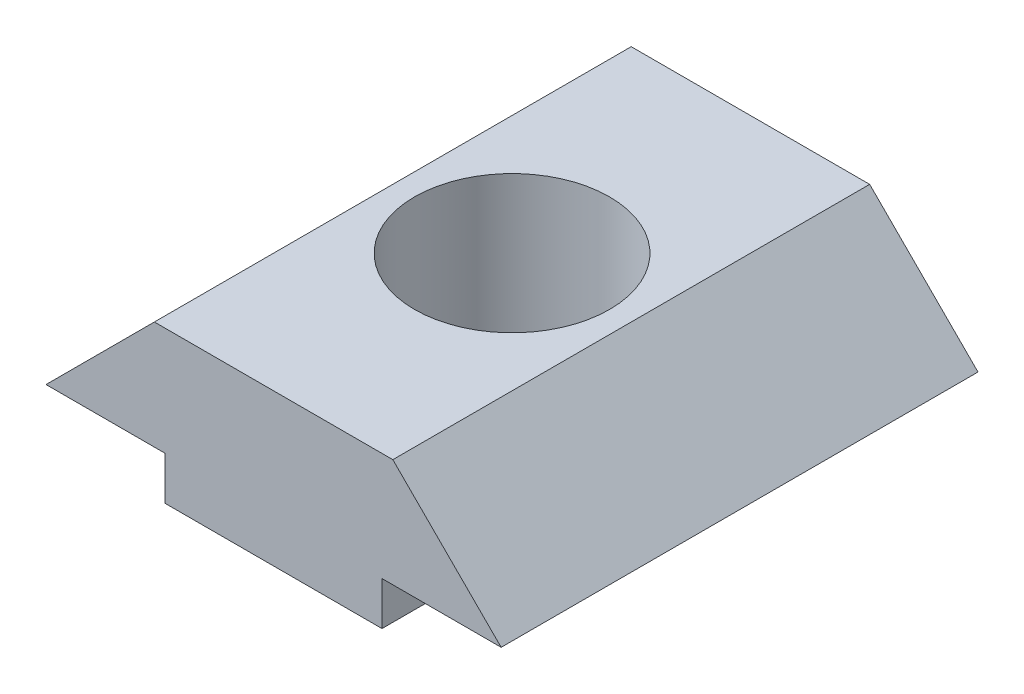
from build123d import *

# Parameters (mm, degrees)
BOSS_EXTRU_1_DEPTH      = 11
ESQUISSE2_R             = 2.25
ENL_V_MAT_EXTRU_1_DEPTH = 13.681186853


with BuildPart() as part:
    # Esquisse1 → Boss.-Extru.1 (new body)
    with BuildSketch(Plane.XY):
        Polygon((2.500951888, 4.75), (-2.5, 4.75), (-2.75, 4.75), (-5.25, 2.25), (-4.5, 2.25), (-2.5, 2.25), (-2.5, 1.25), (2.500951888, 1.25), (2.500951888, 2.25), (4.5, 2.25), (5.25, 2.25), (2.750951888, 4.75), align=None)
    extrude(amount=BOSS_EXTRU_1_DEPTH)

    # Esquisse2 → Enlèv. mat.-Extru.1 (cut, through all)
    with BuildSketch(Plane.XZ.offset(-1.25)):
        with Locations(Location((0.000951888, 5.5, 0), (0, 0, 270))):
            Circle(ESQUISSE2_R)
    extrude(amount=-ENL_V_MAT_EXTRU_1_DEPTH, mode=Mode.SUBTRACT)


solid = part.part
